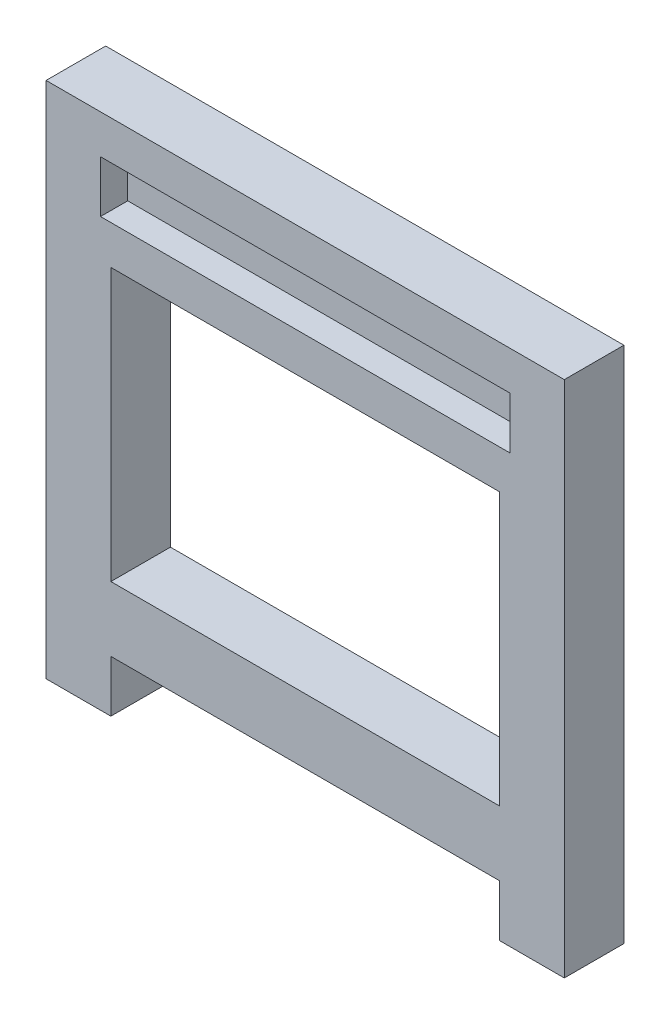
from build123d import *

# Parameters (mm, degrees)
SKETCH1_W           = 15
SKETCH1_H           = 10.5
SKETCH1_W_2         = 15.8
SKETCH1_H_2         = 2
BOSS_EXTRUDE1_DEPTH = 2.3
SKETCH1_2_W         = 15.8
SKETCH1_2_H         = 2
BOSS_EXTRUDE2_DEPTH = 1.25


with BuildPart() as part:
    # Sketch1 → Boss-Extrude1 (new body)
    with BuildSketch(Plane.XY):
        Polygon((0, 0), (0, -2), (2.5, -2), (2.5, 0), (17.5, 0), (17.5, -2), (20, -2), (20, 0), (20, 18), (0, 18), align=None)
        with Locations((10, 7.75)):
            Rectangle(SKETCH1_W, SKETCH1_H, mode=Mode.SUBTRACT)
        with Locations((10, 15.5)):
            Rectangle(SKETCH1_W_2, SKETCH1_H_2, mode=Mode.SUBTRACT)
    extrude(amount=BOSS_EXTRUDE1_DEPTH)

    # Sketch1<2> → Boss-Extrude2 (add)
    with BuildSketch(Plane.XY):
        with Locations((10, 15.5)):
            Rectangle(SKETCH1_2_W, SKETCH1_2_H)
    extrude(amount=BOSS_EXTRUDE2_DEPTH)


solid = part.part
